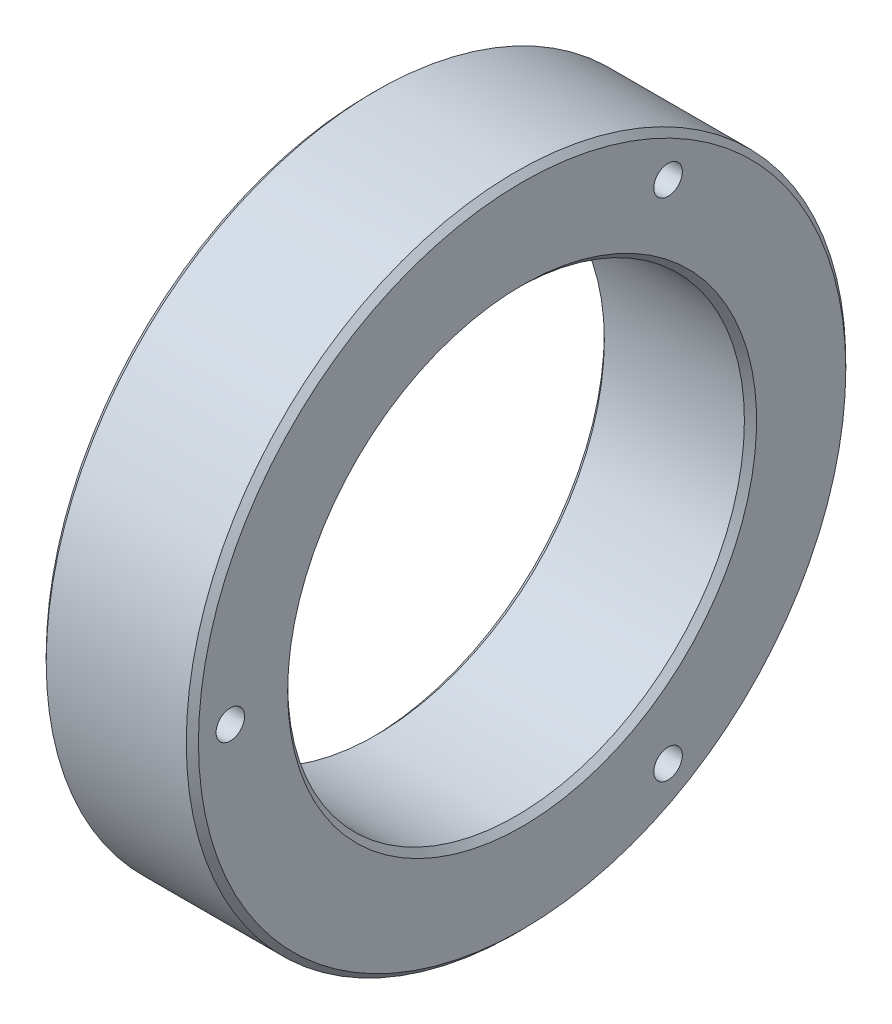
from build123d import *

# Parameters (mm, degrees)
SKETCH1_W           = 25.3746
SKETCH1_H           = 38.1
SKETCH2_R           = 3.5687
CUT_EXTRUDE2_DEPTH  = 123.769007532
SKETCH3_R           = 5.5626
CUT_EXTRUDE4_DEPTH  = 9.652
SKETCH4_R           = 3.5687
CUT_EXTRUDE6_DEPTH  = 123.769007532
SKETCH5_R           = 5.5626
CUT_EXTRUDE8_DEPTH  = 9.652
SKETCH6_R           = 3.5687
CUT_EXTRUDE10_DEPTH = 123.769007532
SKETCH7_R           = 5.5626
CUT_EXTRUDE12_DEPTH = 9.652
SKETCH8_R           = 3.96875
CUT_EXTRUDE14_DEPTH = 25.4
SKETCH9_R           = 3.96875
CUT_EXTRUDE16_DEPTH = 25.4
CHAMFER1_SIZE       = 1.524


with BuildPart() as part:
    # Sketch1 → Revolve1 (revolve)
    with BuildSketch(Plane(origin=(0, 0, 0), x_dir=(0, 1, 0), z_dir=(0, 0, 1)), mode=Mode.PRIVATE) as revolve1_sk:
        with Locations((69.8373, -19.05)):
            Rectangle(SKETCH1_W, SKETCH1_H)
    revolve(revolve1_sk.sketch.rotate(Axis((-25.4, 0, 0), (1, 0, 0)), 90), axis=Axis((-25.4, 0, 0), (1, 0, 0)))

    # Sketch2 → Cut-Extrude2 (cut, through all)
    with BuildSketch(Plane.YZ):
        with Locations(Location((0, 73.025, 0), (0, 0, 90))):
            Circle(SKETCH2_R)
    extrude(amount=CUT_EXTRUDE2_DEPTH, mode=Mode.SUBTRACT)

    # Sketch3 → Cut-Extrude4 (cut)
    with BuildSketch(Plane.YZ):
        with Locations(Location((0, 73.025, 0), (0, 0, 270))):
            Circle(SKETCH3_R)
    extrude(amount=CUT_EXTRUDE4_DEPTH, mode=Mode.SUBTRACT)

    # Sketch4 → Cut-Extrude6 (cut, through all)
    with BuildSketch(Plane.YZ):
        with Locations(Location((-63.246, -36.5252, 0), (0, 0, 90))):
            Circle(SKETCH4_R)
    extrude(amount=CUT_EXTRUDE6_DEPTH, mode=Mode.SUBTRACT)

    # Sketch5 → Cut-Extrude8 (cut)
    with BuildSketch(Plane.YZ):
        with Locations(Location((-63.246, -36.5252, 0), (0, 0, 270))):
            Circle(SKETCH5_R)
    extrude(amount=CUT_EXTRUDE8_DEPTH, mode=Mode.SUBTRACT)

    # Sketch6 → Cut-Extrude10 (cut, through all)
    with BuildSketch(Plane.YZ):
        with Locations(Location((63.246, -36.5252, 0), (0, 0, 90))):
            Circle(SKETCH6_R)
    extrude(amount=CUT_EXTRUDE10_DEPTH, mode=Mode.SUBTRACT)

    # Sketch7 → Cut-Extrude12 (cut)
    with BuildSketch(Plane.YZ):
        with Locations(Location((63.246, -36.5252, 0), (0, 0, 270))):
            Circle(SKETCH7_R)
    extrude(amount=CUT_EXTRUDE12_DEPTH, mode=Mode.SUBTRACT)

    # Sketch8 → Cut-Extrude14 (cut)
    with BuildSketch(Plane.YZ):
        with Locations(Location((-69.85, 0, 0), (0, 0, 270))):
            Circle(SKETCH8_R)
    extrude(amount=CUT_EXTRUDE14_DEPTH, mode=Mode.SUBTRACT)

    # Sketch9 → Cut-Extrude16 (cut)
    with BuildSketch(Plane.YZ):
        with Locations(Location((69.85, 0, 0), (0, 0, 270))):
            Circle(SKETCH9_R)
    extrude(amount=CUT_EXTRUDE16_DEPTH, mode=Mode.SUBTRACT)

    # Chamfer1
    chamfer1_edges = [part.edges().sort_by_distance(p)[0] for p in [
        (0, 0, -57.15),
        (38.1, 0, -57.15),
        (38.1, 0, -82.5246),
        (0, 0, -82.5246),
    ]]
    chamfer(chamfer1_edges, length=CHAMFER1_SIZE)


solid = part.part
